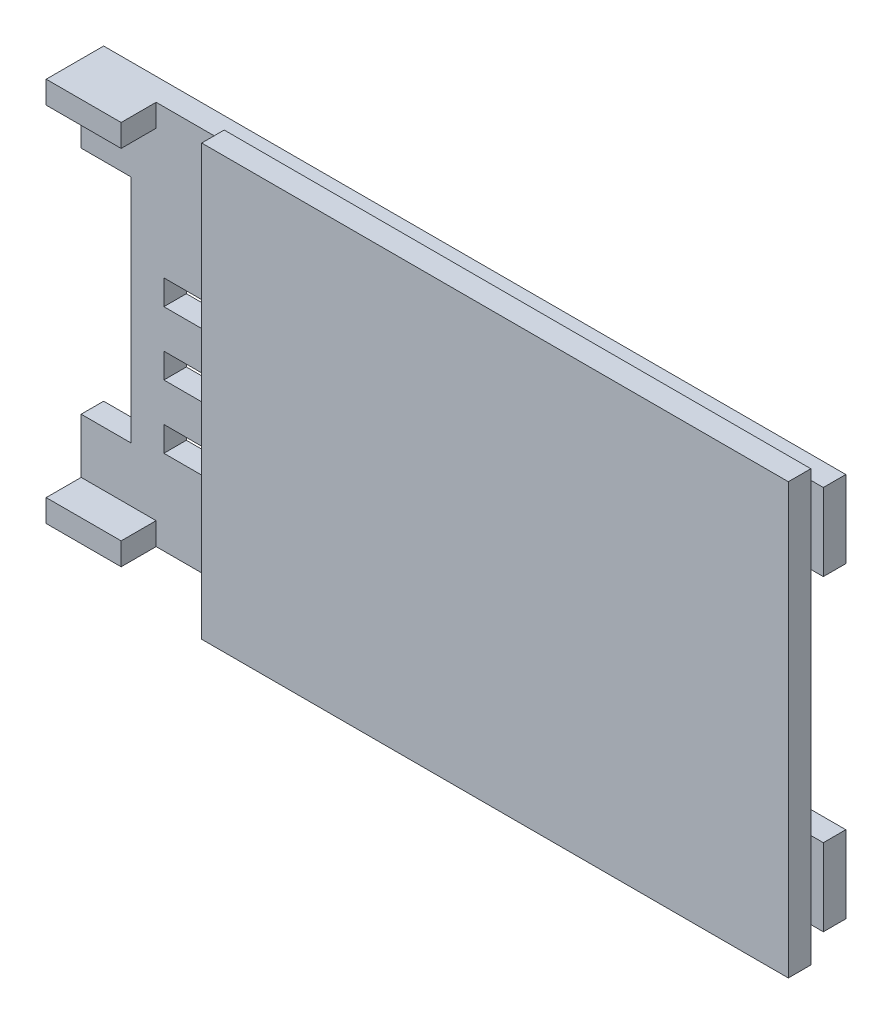
from build123d import *

# Parameters (mm, degrees)
SKETCH1_W           = 6.376063003
SKETCH1_H           = 1
SKETCH1_W_2         = 5.71073469
BOSS_EXTRUDE1_DEPTH = 0.9
SKETCH4_W           = 3
SKETCH4_H           = 0.9
BOSS_EXTRUDE3_DEPTH = 1.399999972
SKETCH5_W           = 23.476292827
SKETCH5_H           = 17.2
BOSS_EXTRUDE4_DEPTH = 0.9


with BuildPart() as part:
    # Sketch1 → Boss-Extrude1 (new body)
    with BuildSketch(Plane.XY):
        Polygon((29.7, 12.31), (29.7, 15.4), (0, 15.4), (0, 12.31), (2, 12.31), (2, 3.09), (0, 3.09), (0, 0), (29.7, 0), (29.7, 3.09), (25.7, 3.09), (25.7, 12.31), align=None)
        with Locations((6.497879886, 3.89)):
            Rectangle(SKETCH1_W, SKETCH1_H, mode=Mode.SUBTRACT)
        with Locations((19.471781996, 3.89)):
            Rectangle(SKETCH1_W_2, SKETCH1_H, mode=Mode.SUBTRACT)
        with Locations((6.497879886, 6.43)):
            Rectangle(SKETCH1_W, SKETCH1_H, mode=Mode.SUBTRACT)
        with Locations((19.471781996, 6.43)):
            Rectangle(SKETCH1_W_2, SKETCH1_H, mode=Mode.SUBTRACT)
        with Locations((6.497879886, 8.97)):
            Rectangle(SKETCH1_W, SKETCH1_H, mode=Mode.SUBTRACT)
        with Locations((19.471781996, 8.97)):
            Rectangle(SKETCH1_W_2, SKETCH1_H, mode=Mode.SUBTRACT)
    extrude(amount=BOSS_EXTRUDE1_DEPTH)

    # Sketch4 → Boss-Extrude3 (add)
    with BuildSketch(Plane.XY.offset(0.9)):
        with Locations((1.5, 14.95)):
            Rectangle(SKETCH4_W, SKETCH4_H)
        with Locations((1.5, 0.45)):
            Rectangle(SKETCH4_W, SKETCH4_H)
    extrude(amount=BOSS_EXTRUDE3_DEPTH)


with BuildPart() as body_2:
    # Sketch5 → Boss-Extrude4 (new body)
    with BuildSketch(Plane(origin=(0, 0, 2.299999972), x_dir=(-1, 0, 0), z_dir=(0, 0, -1))):
        with Locations((-17.961853587, 7.7)):
            Rectangle(SKETCH5_W, SKETCH5_H)
    extrude(amount=BOSS_EXTRUDE4_DEPTH)


solid = Compound([part.part, body_2.part])
